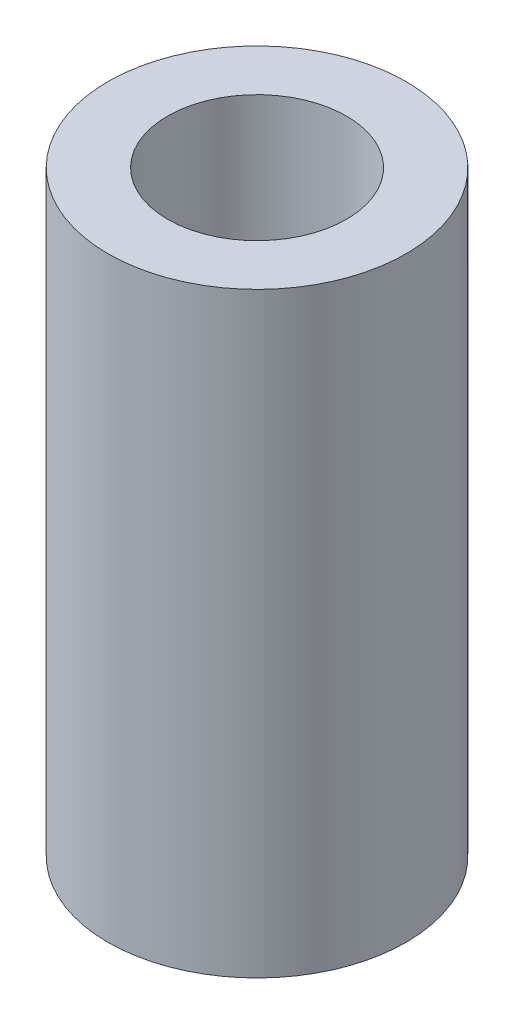
from build123d import *

# Parameters (mm, degrees)
SKETCH1_R           = 5
SKETCH1_R_2         = 3
BOSS_EXTRUDE1_DEPTH = 20


with BuildPart() as part:
    # Sketch1 → Boss-Extrude1 (new body)
    with BuildSketch(Plane(origin=(0, 0, 0), x_dir=(1, 0, 0), z_dir=(0, 1, 0))):
        with Locations(Location((0, 0, 0), (0, 0, 270))):
            Circle(SKETCH1_R)
        with Locations(Location((0, 0, 0), (0, 0, 270))):
            Circle(SKETCH1_R_2, mode=Mode.SUBTRACT)
    extrude(amount=BOSS_EXTRUDE1_DEPTH)


solid = part.part
